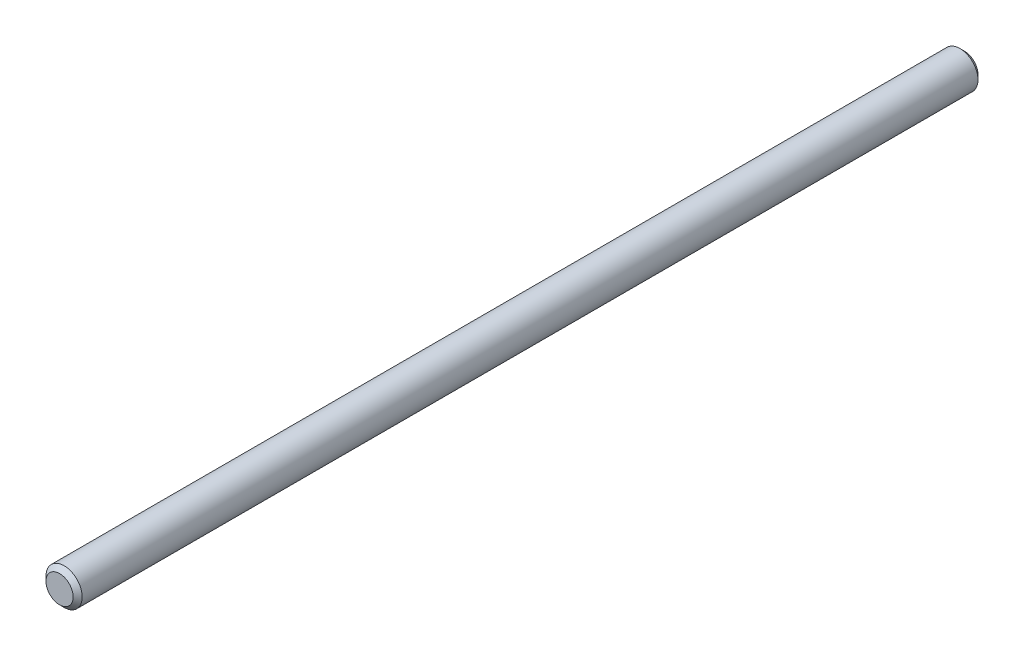
from build123d import *

# Parameters (mm, degrees)
CROQUIS1_R              = 2
SALIENTE_EXTRUIR1_DEPTH = 100
CHAFL_N1_SIZE           = 0.5


with BuildPart() as part:
    # Croquis1 → Saliente-Extruir1 (new body)
    with BuildSketch(Plane.XY):
        Circle(CROQUIS1_R)
    extrude(amount=SALIENTE_EXTRUIR1_DEPTH)

    # Chaflán1
    chafl_n1_edges = [part.edges().sort_by_distance(p)[0] for p in [
        (-2, 0, 0),
        (-2, 0, 100),
    ]]
    chamfer(chafl_n1_edges, length=CHAFL_N1_SIZE)


solid = part.part
